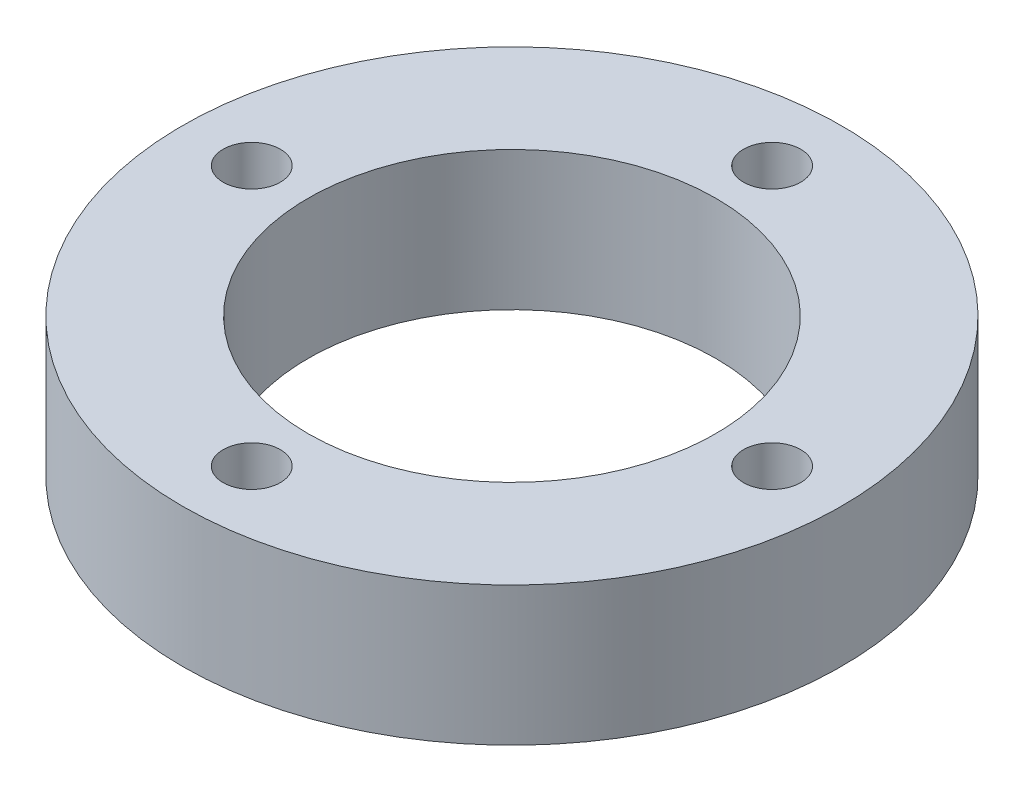
from build123d import *

# Parameters (mm, degrees)
SKETCH1_R                     = 38
SKETCH1_R_2                   = 23.51
SKETCH1_R_3                   = 3.3
BEARING_CARRIER_EXTRUDE_DEPTH = 16


with BuildPart() as part:
    # Sketch1 → Bearing_Carrier_Extrude (new body)
    with BuildSketch(Plane(origin=(0, 0, 0), x_dir=(1, 0, 0), z_dir=(0, 1, 0))):
        with Locations(Location((0, 0, 0), (0, 0, 270))):
            Circle(SKETCH1_R)
        with Locations(Location((0, 0, 0), (0, 0, 270))):
            Circle(SKETCH1_R_2, mode=Mode.SUBTRACT)
        with Locations(Location((-30, 0, 0), (0, 0, 270))):
            Circle(SKETCH1_R_3, mode=Mode.SUBTRACT)
        with Locations(Location((30, 0, 0), (0, 0, 270))):
            Circle(SKETCH1_R_3, mode=Mode.SUBTRACT)
        with Locations(Location((0, -30, 0), (0, 0, 270))):
            Circle(SKETCH1_R_3, mode=Mode.SUBTRACT)
        with Locations(Location((0, 30, 0), (0, 0, 270))):
            Circle(SKETCH1_R_3, mode=Mode.SUBTRACT)
    extrude(amount=BEARING_CARRIER_EXTRUDE_DEPTH)


solid = part.part
